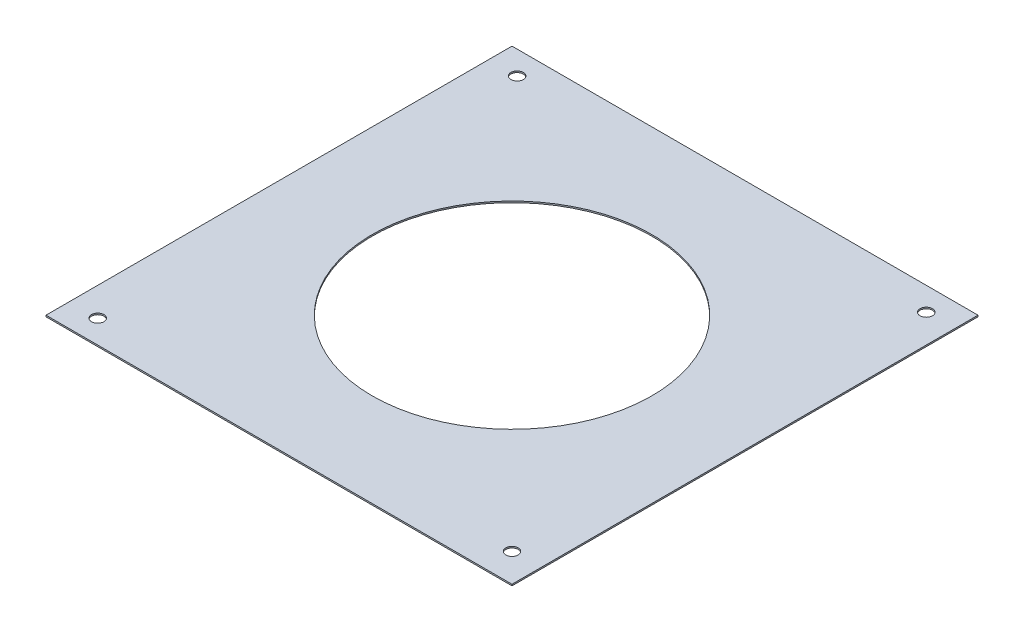
from build123d import *

# Parameters (mm, degrees)
SKETCH1_W           = 254
SKETCH1_H           = 254
SKETCH1_R           = 3.3782
BOSS_EXTRUDE1_DEPTH = 0.79375
SKETCH3_R           = 76.2
CUT_EXTRUDE1_DEPTH  = 180.606876369


with BuildPart() as part:
    # Sketch1 → Boss-Extrude1 (new body)
    with BuildSketch(Plane(origin=(0, 0, 0), x_dir=(1, 0, 0), z_dir=(0, 1, 0))):
        Rectangle(SKETCH1_W, SKETCH1_H)
        with Locations(Location((-111.506, 114.3, 0), (0, 0, 270))):
            Circle(SKETCH1_R, mode=Mode.SUBTRACT)
        with Locations(Location((111.506, 114.3, 0), (0, 0, 270))):
            Circle(SKETCH1_R, mode=Mode.SUBTRACT)
        with Locations(Location((111.506, -111.506, 0), (0, 0, 270))):
            Circle(SKETCH1_R, mode=Mode.SUBTRACT)
        with Locations(Location((-111.506, -114.3, 0), (0, 0, 270))):
            Circle(SKETCH1_R, mode=Mode.SUBTRACT)
    extrude(amount=BOSS_EXTRUDE1_DEPTH)

    # Sketch3 → Cut-Extrude1 (cut, through all)
    with BuildSketch(Plane(origin=(0, 0.79375, 0), x_dir=(1, 0, 0), z_dir=(0, 1, 0))):
        with Locations(Location((0, 0, 0), (0, 0, 270))):
            Circle(SKETCH3_R)
    extrude(amount=-CUT_EXTRUDE1_DEPTH, mode=Mode.SUBTRACT)


solid = part.part
